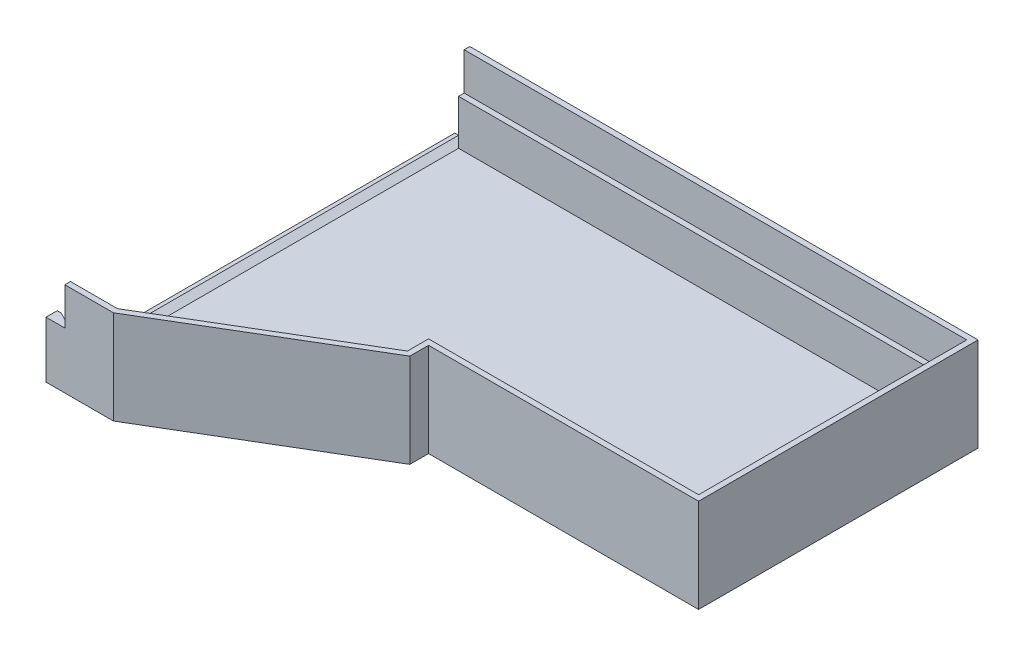
from build123d import *

# Parameters (mm, degrees)
BOSS_EXTRUDE1_DEPTH = 25
CUT_EXTRUDE1_DEPTH  = 22
SKETCH7_W           = 4
SKETCH7_H           = 106
CUT_EXTRUDE2_DEPTH  = 22
SKETCH8_W           = 3
SKETCH8_H           = 106
CUT_EXTRUDE3_DEPTH  = 1.5
SKETCH9_W           = 3
SKETCH9_H           = 23.5
CUT_EXTRUDE4_DEPTH  = 1.5
CUT_EXTRUDE5_DEPTH  = 10
BOSS_EXTRUDE2_DEPTH = 13.5
BOSS_EXTRUDE3_DEPTH = 107.5


with BuildPart() as part:
    # PCB → Boss-Extrude1 (new body)
    with BuildSketch(Plane(origin=(0, 0, 0), x_dir=(1, 0, 0), z_dir=(0, 1, 0))):
        Polygon((-3.5, 3.5), (-3.5, -71), (-75.5, -71), (-75.5, -75.988917258), (-125.036460317, -105.5), (-142, -105.5), (-143, -105.5), (-143, 3.5), (-142, 3.5), align=None)
    extrude(amount=BOSS_EXTRUDE1_DEPTH)

    # Sketch4 → Cut-Extrude1 (cut)
    with BuildSketch(Plane(origin=(0, 25, 0), x_dir=(1, 0, 0), z_dir=(0, 1, 0))):
        Polygon((-6.5, 0.5), (-140, 0.5), (-140, -102.5), (-125.862351474, -102.5), (-78.5, -74.284131037), (-78.5, -68), (-6.5, -68), align=None)
    extrude(amount=-CUT_EXTRUDE1_DEPTH, mode=Mode.SUBTRACT)

    # Sketch7 → Cut-Extrude2 (cut)
    with BuildSketch(Plane(origin=(0, 25, 0), x_dir=(1, 0, 0), z_dir=(0, 1, 0))):
        with Locations((-141, -49.5)):
            Rectangle(SKETCH7_W, SKETCH7_H)
    extrude(amount=-CUT_EXTRUDE2_DEPTH, mode=Mode.SUBTRACT)

    # Sketch8 → Cut-Extrude3 (cut)
    with BuildSketch(Plane(origin=(0, 3, 0), x_dir=(1, 0, 0), z_dir=(0, 1, 0))):
        with Locations((-140.5, -49.5)):
            Rectangle(SKETCH8_W, SKETCH8_H)
    extrude(amount=-CUT_EXTRUDE3_DEPTH, mode=Mode.SUBTRACT)

    # Sketch9 → Cut-Extrude4 (cut)
    with BuildSketch(Plane(origin=(0, 0, 102.5), x_dir=(-1, 0, 0), z_dir=(0, 0, -1))):
        with Locations((140.5, 13.25)):
            Rectangle(SKETCH9_W, SKETCH9_H)
    extrude(amount=-CUT_EXTRUDE4_DEPTH, mode=Mode.SUBTRACT)

    # Sketch10 → Cut-Extrude5 (cut)
    with BuildSketch(Plane(origin=(0, 25, 0), x_dir=(1, 0, 0), z_dir=(0, 1, 0))):
        Polygon((-138, -105.5), (-143, -105.5), (-143, -102.5), (-142, -102.5), (-142, -104), (-139, -104), (-139, -102.5), (-125.862351474, -102.5), (-78.5, -74.284131037), (-78.5, -68), (-6.5, -68), (-6.5, 0.5), (-139, 0.5), (-139, 2), (-5, 2), (-5, -69.5), (-77, -69.5), (-77, -75.136524148), (-125.449405895, -104), (-138, -104), align=None)
    extrude(amount=-CUT_EXTRUDE5_DEPTH, mode=Mode.SUBTRACT)

    # Sketch11 → Boss-Extrude2 (add)
    with BuildSketch(Plane(origin=(0, 1.5, 0), x_dir=(1, 0, 0), z_dir=(0, 1, 0))):
        Polygon((-142, -102.5), (-139, -104), (-142, -104), align=None)
    extrude(amount=BOSS_EXTRUDE2_DEPTH)

    # Sketch12 → Boss-Extrude3 (add)
    with BuildSketch(Plane(origin=(0, 0, -3.5), x_dir=(-1, 0, 0), z_dir=(0, 0, -1))):
        Polygon((139, 1.5), (142, 3), (142, 1.5), align=None)
    extrude(amount=-BOSS_EXTRUDE3_DEPTH)


solid = part.part
